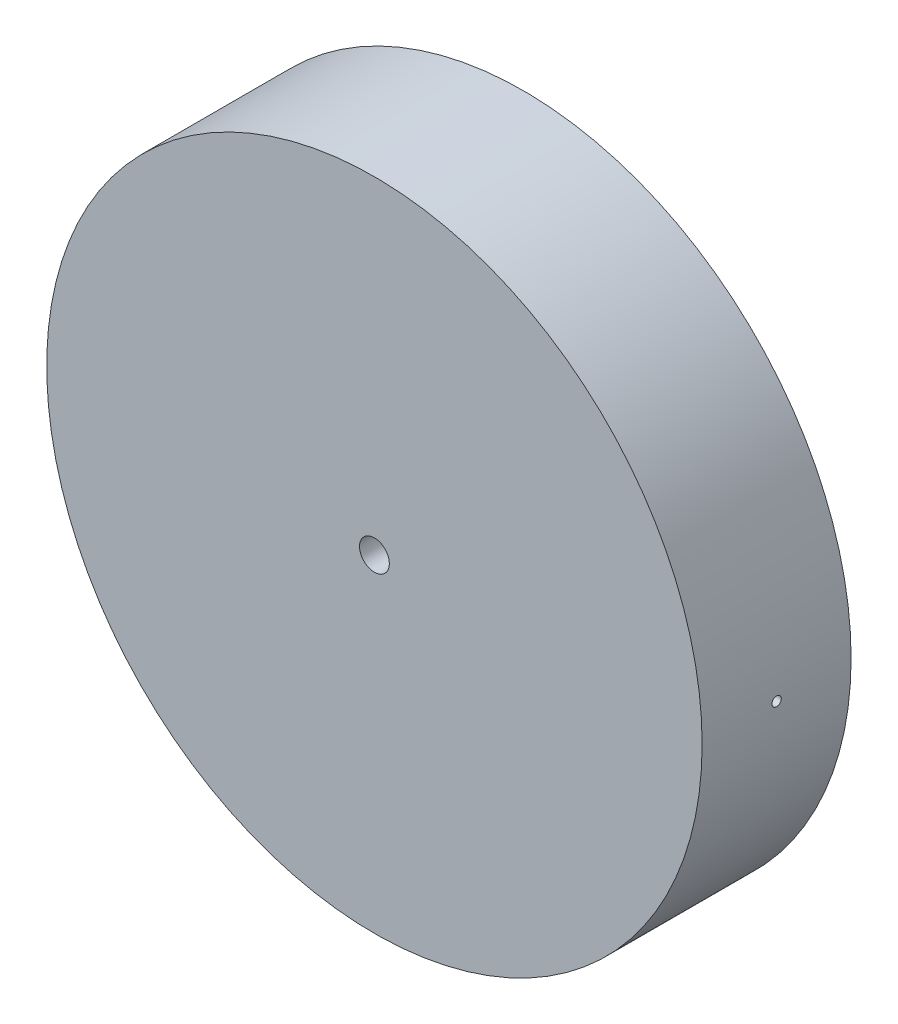
from build123d import *

# Parameters (mm, degrees)
SKETCH1_R         = 88
HUB_DEPTH         = 40
SKETCH2_R         = 4
BORE_DEPTH        = 40
SKETCH3_R         = 1.25
CLAMP_SCREW_DEPTH = 85


with BuildPart() as part:
    # Sketch1 → Hub (new body)
    with BuildSketch(Plane.XY):
        Circle(SKETCH1_R)
    extrude(amount=HUB_DEPTH)

    # Sketch2 → Bore (cut)
    with BuildSketch(Plane.XY):
        Circle(SKETCH2_R)
    extrude(amount=BORE_DEPTH, mode=Mode.SUBTRACT)

    # Sketch3 → Clamp_screw (cut)
    with BuildSketch(Plane(origin=(3.5, 0, 0), x_dir=(0, 0, -1), z_dir=(1, 0, 0))):
        with Locations(Location((-20, 0, 0), (0, 0, 180))):
            Circle(SKETCH3_R)
    extrude(amount=CLAMP_SCREW_DEPTH, mode=Mode.SUBTRACT)


solid = part.part
